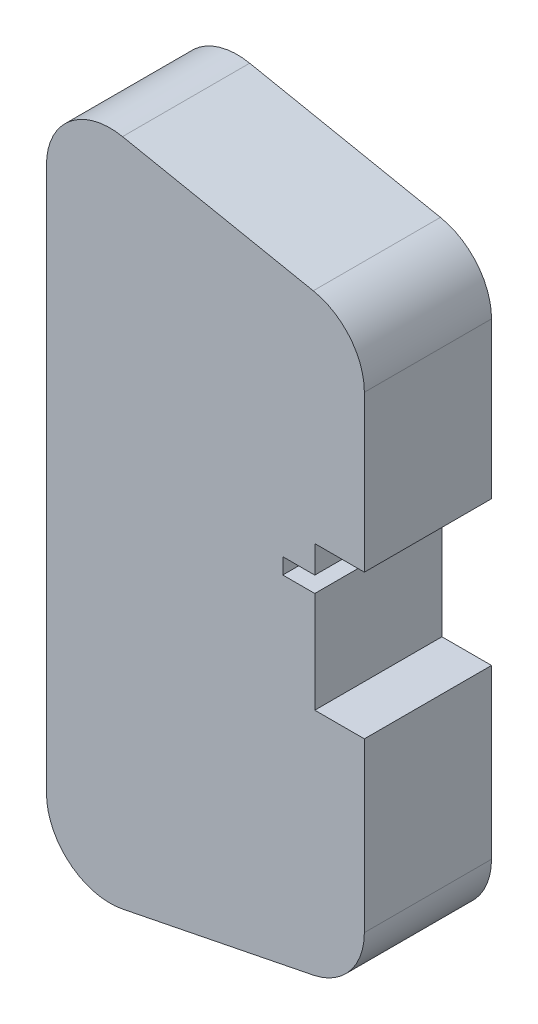
from build123d import *

# Parameters (mm, degrees)
BOSS_EXTRUDE1_DEPTH = 20
SKETCH5_W           = 9
SKETCH5_H           = 1.454272164
CUT_EXTRUDE4_DEPTH  = 10
SKETCH6_R           = 0.5
CUT_EXTRUDE5_DEPTH  = 5
CUT_EXTRUDE6_DEPTH  = 76.41914268
SKETCH11_R          = 1
CUT_EXTRUDE7_DEPTH  = 5


with BuildPart() as part:
    # Sketch1 → Boss-Extrude1 (new body)
    with BuildSketch(Plane.XY):
        with BuildLine():
            Line((0, 42.801960973), (0, -42.801960973))
            ThreePointArc((0, -42.801960973), (3.660110944, -50.535382386), (11.961161351, -52.60776773))
            Line((11.961161351, -52.60776773), (41.961161351, -46.60776773))
            ThreePointArc((41.961161351, -46.60776773), (47.733421413, -43.141850029), (50, -36.801960973))
            Line((50, -36.801960973), (50, 36.801960973))
            ThreePointArc((50, 36.801960973), (47.733421413, 43.141850029), (41.961161351, 46.60776773))
            Line((41.961161351, 46.60776773), (11.961161351, 52.60776773))
            ThreePointArc((11.961161351, 52.60776773), (3.660110944, 50.535382386), (0, 42.801960973))
        make_face()
    extrude(amount=BOSS_EXTRUDE1_DEPTH)

    # Sketch5 → Cut-Extrude4 (cut)
    with BuildSketch(Plane.ZY):
        with Locations((10, 16.569972364)):
            Rectangle(SKETCH5_W, SKETCH5_H)
    extrude(amount=-CUT_EXTRUDE4_DEPTH, mode=Mode.SUBTRACT)

    # Sketch6 → Cut-Extrude5 (cut)
    with BuildSketch(Plane.XZ.offset(-17.297108446)):
        with Locations(Location((2.644871575, 10, 0), (0, 0, 270))):
            Circle(SKETCH6_R)
    extrude(amount=-CUT_EXTRUDE5_DEPTH, mode=Mode.SUBTRACT)

    # Sketch9 → Cut-Extrude6 (cut, through all)
    with BuildSketch(Plane.XY.offset(20)):
        Polygon((42.2, 5.497108446), (42.2, -10.402891554), (50, -10.402891554), (50, 12.297108446), (42.2, 12.297108446), (42.2, 7.997108446), (37.17, 7.997108446), (37.17, 5.497108446), align=None)
    extrude(amount=-CUT_EXTRUDE6_DEPTH, mode=Mode.SUBTRACT)

    # Sketch11 → Cut-Extrude7 (cut)
    with BuildSketch(Plane(origin=(0, 7.997108446, 0), x_dir=(-1, 0, 0), z_dir=(0, -1, 0))):
        with Locations(Location((-39.9, -10, 0), (0, 0, 90))):
            Circle(SKETCH11_R)
    extrude(amount=-CUT_EXTRUDE7_DEPTH, mode=Mode.SUBTRACT)


solid = part.part
